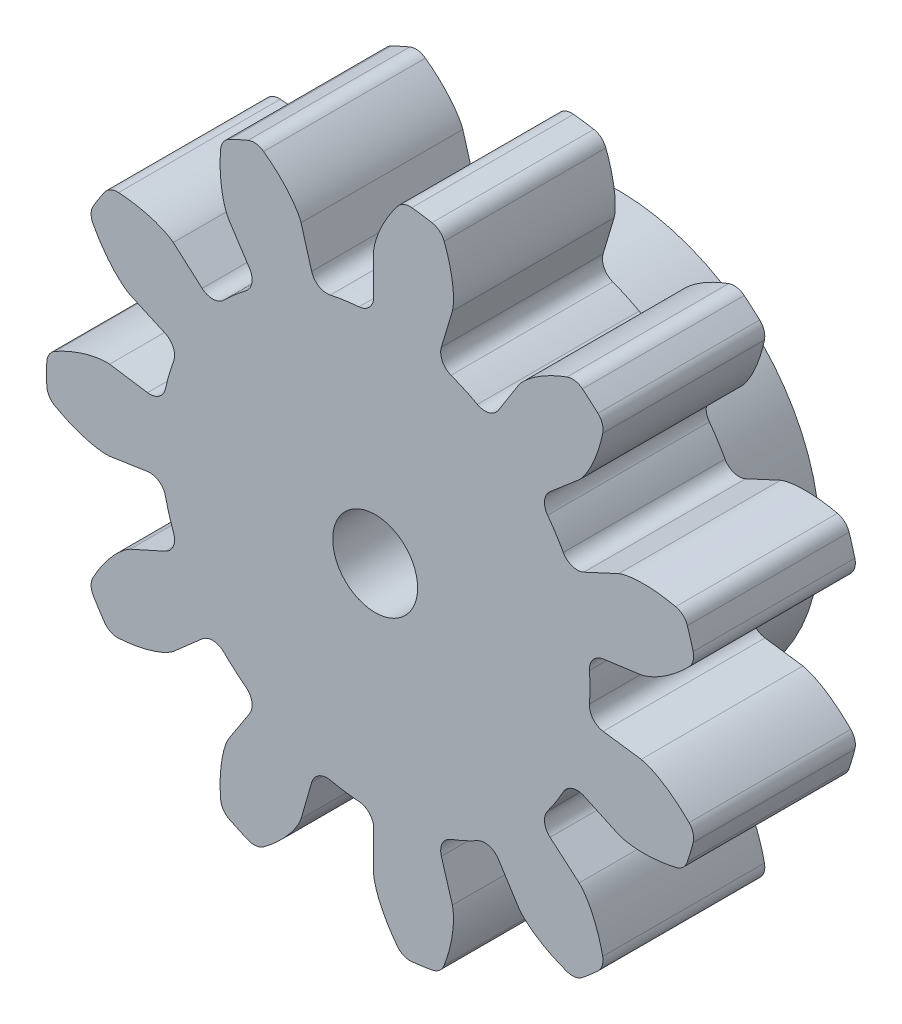
from build123d import *

# Parameters (mm, degrees)
SKETCH1_R                = 8.125
BOSS_EXTRUDE1_DEPTH      = 4
CUT_EXTRUDE1_DEPTH       = 13.16680936
FILLET1_R                = 0.393380952
CIRPATTERN1_COUNT        = 11
FILLET1_OF_CIRPATTERN1_R = 0.393380952
SKETCH4_R                = 5
BOSS_EXTRUDE2_DEPTH      = 2
CUT_EXTRUDE2_DEPTH       = 2
CUT_EXTRUDE2_DEPTH_BACK  = 2
SKETCH3_R                = 2.65
SKETCH5_R                = 1.05
CUT_EXTRUDE3_DEPTH       = 13.134695682


with BuildPart() as part:
    # Sketch1 → Boss-Extrude1 (new body)
    with BuildSketch(Plane.XY):
        Circle(SKETCH1_R)
    extrude(amount=BOSS_EXTRUDE1_DEPTH)

    # Sketch2 → Cut-Extrude1 (cut, through all)
    with BuildSketch(Plane.XY.offset(4)):
        with BuildLine():
            Line((6.578834594, 0.904634661), (5.262976489, 0.72369519))
            ThreePointArc((5.262976489, 0.72369519), (5.3125, 0), (5.262976489, -0.72369519))
            Line((5.262976489, -0.72369519), (6.578834594, -0.904634661))
            add(Edge.make_bspline(
                [(6.578834594, -0.904634661), (6.581246788, -0.905003088), (6.587995109, -0.90614781), (6.60068217, -0.908751358), (6.621266916, -0.913620839), (6.647310056, -0.92073549), (6.680734793, -0.930970964), (6.719783262, -0.944359553), (6.762326073, -0.960459653), (6.808181994, -0.979462461), (6.853528227, -0.99972757), (6.898368447, -1.021151473), (6.942666589, -1.043578091), (6.995866612, -1.072016355), (7.05900573, -1.107879986), (7.131796431, -1.152339984), (7.213116511, -1.205742517), (7.294595096, -1.263308237), (7.373593224, -1.322519397), (7.45198258, -1.385246906), (7.526811228, -1.447993431), (7.60298402, -1.516079323), (7.672512407, -1.580412769), (7.748611303, -1.65564951), (7.809505474, -1.717294929), (7.870856805, -1.783565861), (7.900485341, -1.816200455), (7.91552883, -1.833038007)],
                knots=[0, 0, 0, 0, 0, 0.005376749, 0.015083688, 0.02853182, 0.04661014, 0.064854849, 0.092110525, 0.119476176, 0.146842496, 0.174208854, 0.201574956, 0.228941013, 0.256307345, 0.307035032, 0.361767352, 0.416499661, 0.471231937, 0.525964282, 0.580696616, 0.635428982, 0.690161387, 0.744893688, 0.799626082, 0.854358408, 0.909090915, 0.909090915, 0.909090915, 0.909090915, 0.909090915], degree=4))
            ThreePointArc((7.91552883, -1.833038007), (8.072462349, -0.922483944), (8.125, 0))
            ThreePointArc((8.125, 0), (8.072462349, 0.922483944), (7.91552883, 1.833038007))
            add(Edge.make_bspline(
                [(6.578834594, 0.904634661), (6.581246788, 0.905003088), (6.587995109, 0.90614781), (6.60068217, 0.908751358), (6.621266916, 0.913620839), (6.647310056, 0.92073549), (6.680734793, 0.930970964), (6.719783262, 0.944359553), (6.762326073, 0.960459653), (6.808181994, 0.979462461), (6.853528227, 0.99972757), (6.898368447, 1.021151473), (6.942666589, 1.043578091), (6.995866612, 1.072016355), (7.05900573, 1.107879986), (7.131796431, 1.152339984), (7.213116511, 1.205742517), (7.294595096, 1.263308237), (7.373593224, 1.322519397), (7.45198258, 1.385246906), (7.526811228, 1.447993431), (7.60298402, 1.516079323), (7.672512407, 1.580412769), (7.748611303, 1.65564951), (7.809505474, 1.717294929), (7.870856805, 1.783565861), (7.900485341, 1.816200455), (7.91552883, 1.833038007)],
                knots=[0, 0, 0, 0, 0, 0.005376749, 0.015083688, 0.02853182, 0.04661014, 0.064854849, 0.092110525, 0.119476176, 0.146842496, 0.174208854, 0.201574956, 0.228941013, 0.256307345, 0.307035032, 0.361767352, 0.416499661, 0.471231937, 0.525964282, 0.580696616, 0.635428982, 0.690161387, 0.744893688, 0.799626082, 0.854358408, 0.909090915, 0.909090915, 0.909090915, 0.909090915, 0.909090915], degree=4))
        make_face()
    cut_extrude1 = extrude(amount=-CUT_EXTRUDE1_DEPTH, mode=Mode.SUBTRACT)

    # Fillet1
    fillet1_edges = [part.edges().sort_by_distance(p)[0] for p in [
        (5.262976489, -0.72369519, 2),
        (5.262976489, 0.72369519, 2),
        (7.91552883, -1.833038007, 2),
        (7.91552883, 1.833038007, 2),
    ]]
    fillet(fillet1_edges, radius=FILLET1_R)

    # CirPattern1: Cut-Extrude1 ×11 about axis
    cirpattern1_axis = Axis((0, 0, 0), (0, 0, 1))
    for i in range(1, CIRPATTERN1_COUNT):
        add(cut_extrude1.rotate(cirpattern1_axis, i * 360 / CIRPATTERN1_COUNT), mode=Mode.SUBTRACT)

    # Fillet1 of CirPattern1
    fillet1_of_cirpattern1_edges = [part.edges().sort_by_distance(p)[0] for p in [
        (4.818756724, 2.236568776, 2),
        (4.036238405, 3.454191047, 2),
        (7.649981759, 2.737408278, 2),
        (5.667951426, 5.821507677, 2),
        (2.844615746, 4.486737958, 2),
        (1.528023147, 5.088005652, 2),
        (4.955619532, 6.438746777, 2),
        (1.620839492, 7.961689792, 2),
        (-0.032670631, 5.312399541, 2),
        (-1.465328665, 5.106414413, 2),
        (0.687883118, 8.095828668, 2),
        (-2.940877528, 7.574091653, 2),
        (-2.899584314, 4.451411805, 2),
        (-3.993448978, 3.503572678, 2),
        (-3.798251326, 7.182542159, 2),
        (-6.568886713, 4.78177293, 2),
        (-4.845900465, 2.177132273, 2),
        (-5.253677458, 0.788371373, 2),
        (-7.078467811, 3.988849264, 2),
        (-8.11132078, 0.471275088, 2),
        (-5.253677458, -0.788371373, 2),
        (-4.845900465, -2.177132273, 2),
        (-8.11132078, -0.471275088, 2),
        (-7.078467811, -3.988849264, 2),
        (-3.993448978, -3.503572678, 2),
        (-2.899584314, -4.451411805, 2),
        (-6.568886713, -4.78177293, 2),
        (-3.798251326, -7.182542159, 2),
        (-1.465328665, -5.106414413, 2),
        (-0.032670631, -5.312399541, 2),
        (-2.940877528, -7.574091653, 2),
        (0.687883118, -8.095828668, 2),
        (1.528023147, -5.088005652, 2),
        (2.844615746, -4.486737958, 2),
        (1.620839492, -7.961689792, 2),
        (4.955619532, -6.438746777, 2),
        (4.036238405, -3.454191047, 2),
        (4.818756724, -2.236568776, 2),
        (5.667951426, -5.821507677, 2),
        (7.649981759, -2.737408278, 2),
    ]]
    fillet(fillet1_of_cirpattern1_edges, radius=FILLET1_OF_CIRPATTERN1_R)

    # Sketch4 → Boss-Extrude2 (add)
    with BuildSketch(Plane.XY):
        Circle(SKETCH4_R)
    extrude(amount=-BOSS_EXTRUDE2_DEPTH)

    # Sketch3 → Cut-Extrude2 (cut, two sides: drawn at the far end of the back side and taken through both)
    with BuildSketch(Plane.XY.offset(-CUT_EXTRUDE2_DEPTH_BACK)):
        Circle(SKETCH3_R)
    extrude(amount=CUT_EXTRUDE2_DEPTH + CUT_EXTRUDE2_DEPTH_BACK, mode=Mode.SUBTRACT)

    # Sketch5 → Cut-Extrude3 (cut, through all)
    with BuildSketch(Plane.XY):
        Circle(SKETCH5_R)
    extrude(amount=CUT_EXTRUDE3_DEPTH, mode=Mode.SUBTRACT)


solid = part.part
